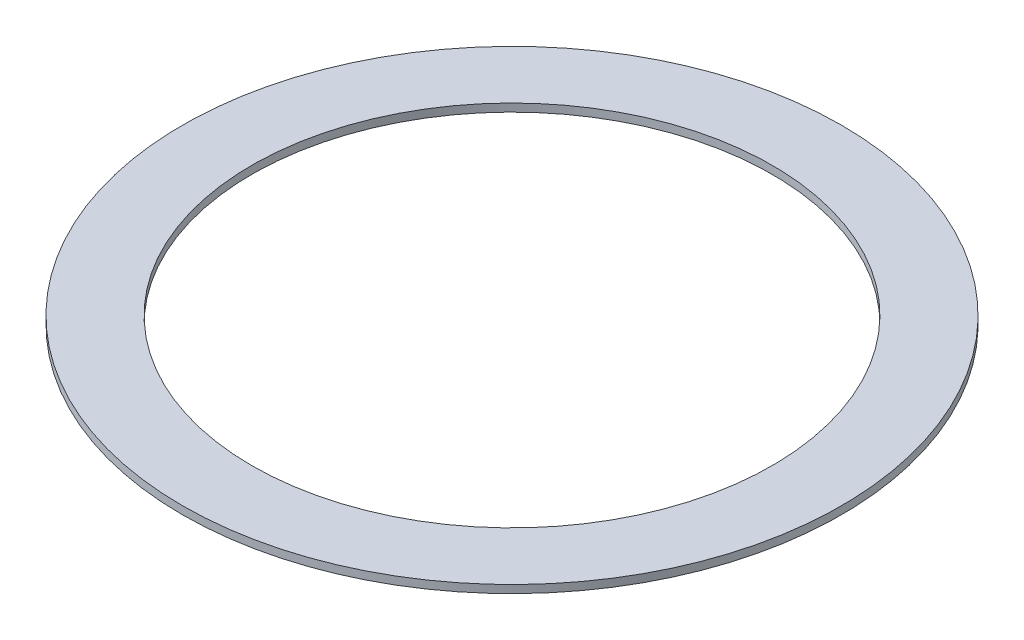
from build123d import *

# Parameters (mm, degrees)
SKETCH1_R           = 20.9
SKETCH1_R_2         = 16.5
BOSS_EXTRUDE1_DEPTH = 0.5


with BuildPart() as part:
    # Sketch1 → Boss-Extrude1 (new body)
    with BuildSketch(Plane(origin=(0, 0, 0), x_dir=(1, 0, 0), z_dir=(0, 1, 0))):
        with Locations(Location((0, 0, 0), (0, 0, 270))):
            Circle(SKETCH1_R)
        with Locations(Location((0, 0, 0), (0, 0, 270))):
            Circle(SKETCH1_R_2, mode=Mode.SUBTRACT)
    extrude(amount=BOSS_EXTRUDE1_DEPTH)


solid = part.part
